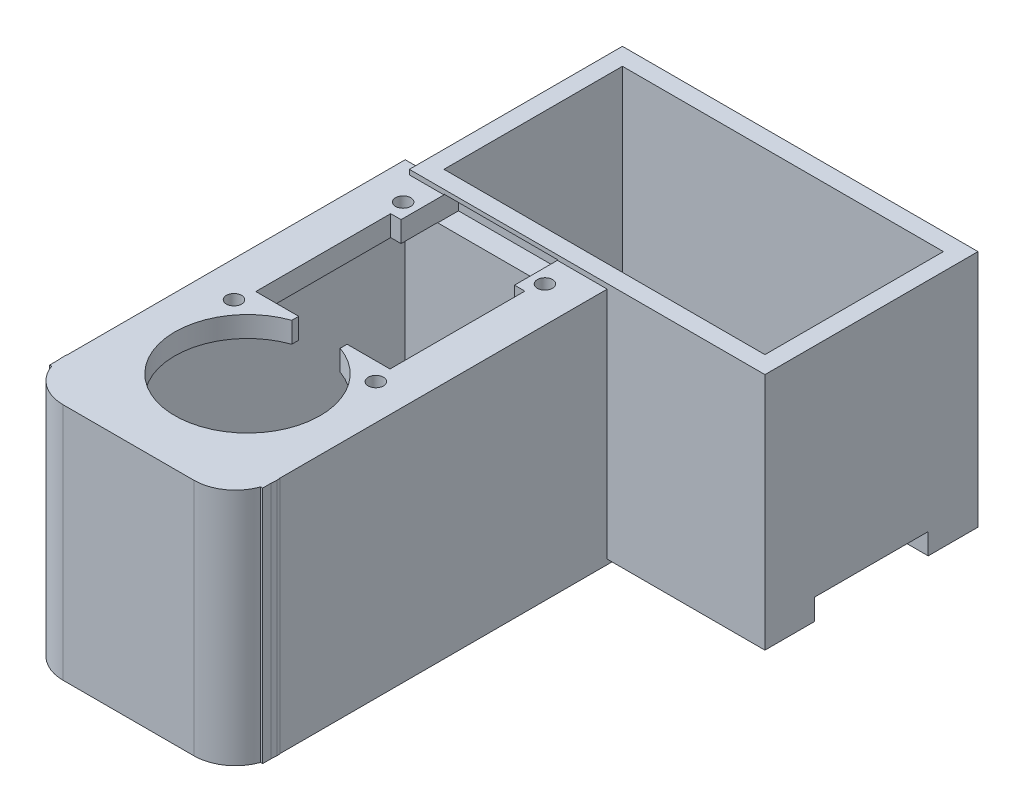
from build123d import *

# Parameters (mm, degrees)
S_BOX1_W        = 30.8
S_BOX1_H        = 34.5
BOSS_1_DEPTH    = 2.5
S_BOX2_W        = 30.8
S_BOX2_H        = 34.5
BOSS_2_DEPTH    = 2.5
S_BOX3_W        = 2.5
S_BOX3_H        = 34.5
BOSS_3_DEPTH    = 51.4
S_BOX4_W        = 2.5
S_BOX4_H        = 34.5
BOSS_4_DEPTH    = 51.4
S_BOX5_W        = 30.8
S_BOX5_H        = 3
BOSS_5_DEPTH    = 51.4
S_BOX6_W        = 2.5
S_BOX6_H        = 34.5
BOSS_6_DEPTH    = 30.8
S_BOX7_W        = 2.5
S_BOX7_H        = 34.5
BOSS_7_DEPTH    = 30.8
S_BOX8_W        = 51.4
S_BOX8_H        = 34.5
BOSS_8_DEPTH    = 2.5
S_BOX9_W        = 51.4
S_BOX9_H        = 34.5
BOSS_9_DEPTH    = 2.5
S_BOX10_W       = 51.4
S_BOX10_H       = 3
BOSS_10_DEPTH   = 30.8
BOSS_11_DEPTH   = 34.5
S_HOLE12_R      = 10.5
HOLE_12_DEPTH   = 3.2
S_CUT13_W       = 19.4
S_CUT13_H       = 3.15
POCKET_13_DEPTH = 19.5
S_CUT14_W       = 16.4
S_CUT14_H       = 3.15
POCKET_14_DEPTH = 8.3
S_CUT15_W       = 7
S_CUT15_H       = 3.15
POCKET_15_DEPTH = 11
S_HOLE16_R      = 1.1
HOLE_16_DEPTH   = 3.2
S_HOLE17_R      = 1.1
HOLE_17_DEPTH   = 3.2
S_HOLE18_R      = 1.1
HOLE_18_DEPTH   = 3.2
S_HOLE19_R      = 1.1
HOLE_19_DEPTH   = 3.2
S_HOLE20_R      = 10.5
HOLE_20_DEPTH   = 3.2
S_CUT21_W       = 19.5
S_CUT21_H       = 3.15
POCKET_21_DEPTH = 19.4
S_CUT22_W       = 8.3
S_CUT22_H       = 3.15
POCKET_22_DEPTH = 16.4
S_CUT23_W       = 11
S_CUT23_H       = 3.15
POCKET_23_DEPTH = 7
S_HOLE24_R      = 1.1
HOLE_24_DEPTH   = 3.2
S_HOLE25_R      = 1.1
HOLE_25_DEPTH   = 3.2
S_HOLE26_R      = 1.1
HOLE_26_DEPTH   = 3.2
S_HOLE27_R      = 1.1
HOLE_27_DEPTH   = 3.2


with BuildPart() as part:
    # S_box1 → Boss_1 (new body)
    with BuildSketch(Plane.XY.offset(-38.2)):
        with Locations((0, 20.15)):
            Rectangle(S_BOX1_W, S_BOX1_H)
    extrude(amount=BOSS_1_DEPTH)



with BuildPart() as body_2:
    # S_box2 → Boss_2 (new body)
    with BuildSketch(Plane.XY.offset(10.7)):
        with Locations((0, 20.15)):
            Rectangle(S_BOX2_W, S_BOX2_H)
    extrude(amount=BOSS_2_DEPTH)


with BuildPart() as part_1:
    add(part.part)

    add(body_2.part)  # Boss_3 merges body 2
    # S_box3 → Boss_3 (add)
    with BuildSketch(Plane.XY.offset(-38.2)):
        with Locations((-14.15, 20.15)):
            Rectangle(S_BOX3_W, S_BOX3_H)
    extrude(amount=BOSS_3_DEPTH)

    # S_box4 → Boss_4 (add)
    with BuildSketch(Plane.XY.offset(-38.2)):
        with Locations((14.15, 20.15)):
            Rectangle(S_BOX4_W, S_BOX4_H)
    extrude(amount=BOSS_4_DEPTH)

    # S_box5 → Boss_5 (add)
    with BuildSketch(Plane.XY.offset(-38.2)):
        with Locations((0, 35.9)):
            Rectangle(S_BOX5_W, S_BOX5_H)
    extrude(amount=BOSS_5_DEPTH)

    # S_box6 → Boss_6 (add)
    with BuildSketch(Plane.XY.offset(-67.4)):
        with Locations((-11.95, 20.85)):
            Rectangle(S_BOX6_W, S_BOX6_H)
    extrude(amount=BOSS_6_DEPTH)



with BuildPart() as body_2_2:
    # S_box7 → Boss_7 (new body)
    with BuildSketch(Plane.XY.offset(-67.4)):
        with Locations((36.95, 20.85)):
            Rectangle(S_BOX7_W, S_BOX7_H)
    extrude(amount=BOSS_7_DEPTH)


with BuildPart() as part_2:
    add(part_1.part)

    add(body_2_2.part)  # Boss_8 merges body 2 2
    # S_box8 → Boss_8 (add)
    with BuildSketch(Plane.XY.offset(-67.4)):
        with Locations((12.5, 20.85)):
            Rectangle(S_BOX8_W, S_BOX8_H)
    extrude(amount=BOSS_8_DEPTH)

    # S_box9 → Boss_9 (add)
    with BuildSketch(Plane.XY.offset(-39.1)):
        with Locations((12.5, 20.85)):
            Rectangle(S_BOX9_W, S_BOX9_H)
    extrude(amount=BOSS_9_DEPTH)

    # S_box10 → Boss_10 (add)
    with BuildSketch(Plane.XY.offset(-67.4)):
        with Locations((12.5, 5.1)):
            Rectangle(S_BOX10_W, S_BOX10_H)
    extrude(amount=BOSS_10_DEPTH)

    # S_prism11 → Boss_11 (add)
    with BuildSketch(Plane(origin=(0, 2.9, 0), x_dir=(1, 0, 0), z_dir=(0, 1, 0))):
        with BuildLine():
            Line((-15.45, -10.75), (15.45, -10.75))
            Line((15.45, -10.75), (15.45, -11.2))
            ThreePointArc((15.45, -11.2), (13.6926, -15.4426), (9.45, -17.2))
            Line((9.45, -17.2), (-9.45, -17.2))
            ThreePointArc((-9.45, -17.2), (-13.6926, -15.4426), (-15.45, -11.2))
            Line((-15.45, -11.2), (-15.45, -10.75))
        make_face()
    extrude(amount=BOSS_11_DEPTH)

    # S_hole12 → Hole_12 (cut)
    with BuildSketch(Plane(origin=(0, 34.3, 0), x_dir=(1, 0, 0), z_dir=(0, 1, 0))):
        with Locations(Location((0, 0, 0), (0, 0, 90))):
            Circle(S_HOLE12_R)
    extrude(amount=HOLE_12_DEPTH, mode=Mode.SUBTRACT)

    # S_cut13 → Pocket_13 (cut)
    with BuildSketch(Plane.XY.offset(-30.4)):
        with Locations((0, 35.925)):
            Rectangle(S_CUT13_W, S_CUT13_H)
    extrude(amount=POCKET_13_DEPTH, mode=Mode.SUBTRACT)

    # S_cut14 → Pocket_14 (cut)
    with BuildSketch(Plane.XY.offset(-38.7)):
        with Locations((0, 35.925)):
            Rectangle(S_CUT14_W, S_CUT14_H)
    extrude(amount=POCKET_14_DEPTH, mode=Mode.SUBTRACT)

    # S_cut15 → Pocket_15 (cut)
    with BuildSketch(Plane.XY.offset(-11)):
        with Locations((0, 35.925)):
            Rectangle(S_CUT15_W, S_CUT15_H)
    extrude(amount=POCKET_15_DEPTH, mode=Mode.SUBTRACT)

    # S_hole16 → Hole_16 (cut)
    with BuildSketch(Plane(origin=(0, 34.3, 0), x_dir=(1, 0, 0), z_dir=(0, 1, 0))):
        with Locations(Location((-10.25, 8.3, 0), (0, 0, 90))):
            Circle(S_HOLE16_R)
    extrude(amount=HOLE_16_DEPTH, mode=Mode.SUBTRACT)

    # S_hole17 → Hole_17 (cut)
    with BuildSketch(Plane(origin=(0, 34.3, 0), x_dir=(1, 0, 0), z_dir=(0, 1, 0))):
        with Locations(Location((10.25, 8.3, 0), (0, 0, 90))):
            Circle(S_HOLE17_R)
    extrude(amount=HOLE_17_DEPTH, mode=Mode.SUBTRACT)

    # S_hole18 → Hole_18 (cut)
    with BuildSketch(Plane(origin=(0, 34.3, 0), x_dir=(1, 0, 0), z_dir=(0, 1, 0))):
        with Locations(Location((-10.25, 32.75, 0), (0, 0, 90))):
            Circle(S_HOLE18_R)
    extrude(amount=HOLE_18_DEPTH, mode=Mode.SUBTRACT)

    # S_hole19 → Hole_19 (cut)
    with BuildSketch(Plane(origin=(0, 34.3, 0), x_dir=(1, 0, 0), z_dir=(0, 1, 0))):
        with Locations(Location((10.25, 32.75, 0), (0, 0, 90))):
            Circle(S_HOLE19_R)
    extrude(amount=HOLE_19_DEPTH, mode=Mode.SUBTRACT)

    # S_hole20 → Hole_20 (cut)
    with BuildSketch(Plane(origin=(0, 3.5, 0), x_dir=(1, 0, 0), z_dir=(0, 1, 0))):
        with Locations(Location((0, 52, 0), (0, 0, 90))):
            Circle(S_HOLE20_R)
    extrude(amount=HOLE_20_DEPTH, mode=Mode.SUBTRACT)

    # S_cut21 → Pocket_21 (cut)
    with BuildSketch(Plane.XY.offset(-61.7)):
        with Locations((20.65, 5.075)):
            Rectangle(S_CUT21_W, S_CUT21_H)
    extrude(amount=POCKET_21_DEPTH, mode=Mode.SUBTRACT)

    # S_cut22 → Pocket_22 (cut)
    with BuildSketch(Plane.XY.offset(-60.2)):
        with Locations((34.55, 5.075)):
            Rectangle(S_CUT22_W, S_CUT22_H)
    extrude(amount=POCKET_22_DEPTH, mode=Mode.SUBTRACT)

    # S_cut23 → Pocket_23 (cut)
    with BuildSketch(Plane.XY.offset(-55.5)):
        with Locations((5.5, 5.075)):
            Rectangle(S_CUT23_W, S_CUT23_H)
    extrude(amount=POCKET_23_DEPTH, mode=Mode.SUBTRACT)

    # S_hole24 → Hole_24 (cut)
    with BuildSketch(Plane(origin=(0, 3.5, 0), x_dir=(1, 0, 0), z_dir=(0, 1, 0))):
        with Locations(Location((8.3, 62.25, 0), (0, 0, 90))):
            Circle(S_HOLE24_R)
    extrude(amount=HOLE_24_DEPTH, mode=Mode.SUBTRACT)

    # S_hole25 → Hole_25 (cut)
    with BuildSketch(Plane(origin=(0, 3.5, 0), x_dir=(1, 0, 0), z_dir=(0, 1, 0))):
        with Locations(Location((8.3, 41.75, 0), (0, 0, 90))):
            Circle(S_HOLE25_R)
    extrude(amount=HOLE_25_DEPTH, mode=Mode.SUBTRACT)

    # S_hole26 → Hole_26 (cut)
    with BuildSketch(Plane(origin=(0, 3.5, 0), x_dir=(1, 0, 0), z_dir=(0, 1, 0))):
        with Locations(Location((32.75, 62.25, 0), (0, 0, 90))):
            Circle(S_HOLE26_R)
    extrude(amount=HOLE_26_DEPTH, mode=Mode.SUBTRACT)

    # S_hole27 → Hole_27 (cut)
    with BuildSketch(Plane(origin=(0, 3.5, 0), x_dir=(1, 0, 0), z_dir=(0, 1, 0))):
        with Locations(Location((32.75, 41.75, 0), (0, 0, 90))):
            Circle(S_HOLE27_R)
    extrude(amount=HOLE_27_DEPTH, mode=Mode.SUBTRACT)


solid = part_2.part
